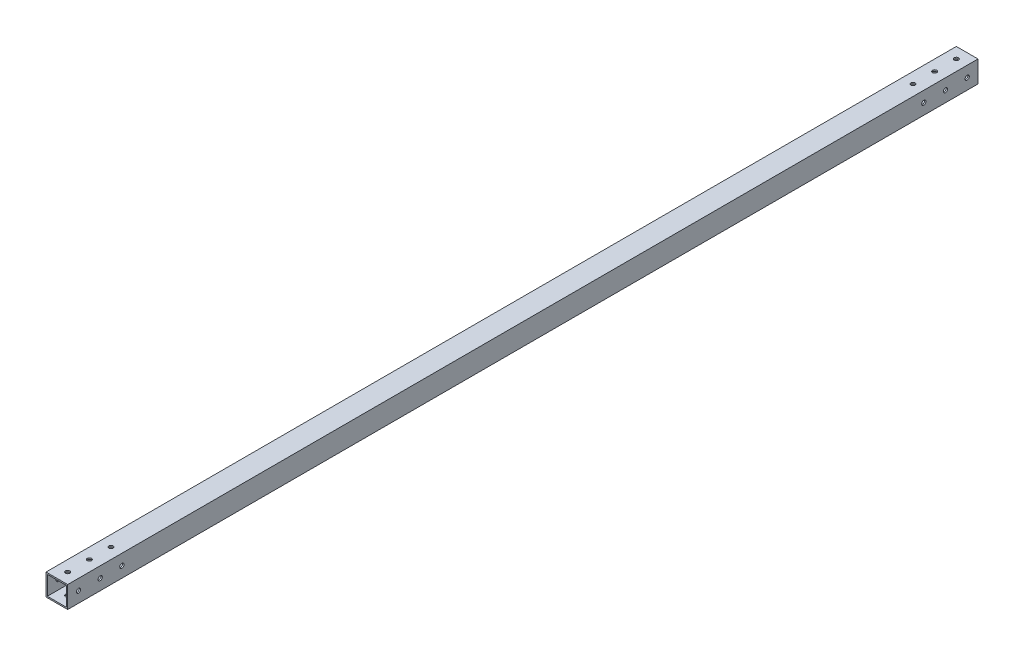
from build123d import *

# Parameters (mm, degrees)
SKETCH1_W           = 25.4
SKETCH1_H           = 25.4
BOSS_EXTRUDE1_DEPTH = 533.4
SHELL1_T            = -1.5875
SKETCH3_R           = 2.4892
CUT_EXTRUDE1_DEPTH  = 533.4
SKETCH4_R           = 2.4892
CUT_EXTRUDE2_DEPTH  = 533.4


with BuildPart() as part:
    # Sketch1 → Boss-Extrude1 (new, symmetric)
    with BuildSketch(Plane.XY):
        with Locations((12.7, 12.7)):
            Rectangle(SKETCH1_W, SKETCH1_H)
    extrude(amount=BOSS_EXTRUDE1_DEPTH, both=True)

    # Shell1
    shell1_openings = [part.faces().sort_by_distance(p)[0] for p in [
        (12.7, 12.7, 533.4),
        (12.7, 12.7, -533.4),
    ]]
    offset(amount=SHELL1_T, openings=shell1_openings, kind=Kind.INTERSECTION)

    # Sketch3 → Cut-Extrude1 (cut, symmetric)
    with BuildSketch(Plane(origin=(0, 25.4, 0), x_dir=(1, 0, 0), z_dir=(0, 1, 0))):
        with Locations(Location((12.7, -520.7, 0), (0, 0, 90))):
            Circle(SKETCH3_R)
        with Locations(Location((12.7, -495.3, 0), (0, 0, 90))):
            Circle(SKETCH3_R)
        with Locations(Location((12.7, -469.9, 0), (0, 0, 90))):
            Circle(SKETCH3_R)
    cut_extrude1 = extrude(amount=CUT_EXTRUDE1_DEPTH, both=True, mode=Mode.SUBTRACT)

    # Sketch4 → Cut-Extrude2 (cut, symmetric)
    with BuildSketch(Plane.ZY):
        with Locations((520.7, 12.7)):
            Circle(SKETCH4_R)
        with Locations((495.3, 12.7)):
            Circle(SKETCH4_R)
        with Locations((469.9, 12.7)):
            Circle(SKETCH4_R)
    cut_extrude2 = extrude(amount=CUT_EXTRUDE2_DEPTH, both=True, mode=Mode.SUBTRACT)

    # Mirror1: Cut-Extrude1, Cut-Extrude2 across plane
    add(cut_extrude1.mirror(Plane.XY), mode=Mode.SUBTRACT)
    add(cut_extrude2.mirror(Plane.XY), mode=Mode.SUBTRACT)


solid = part.part
